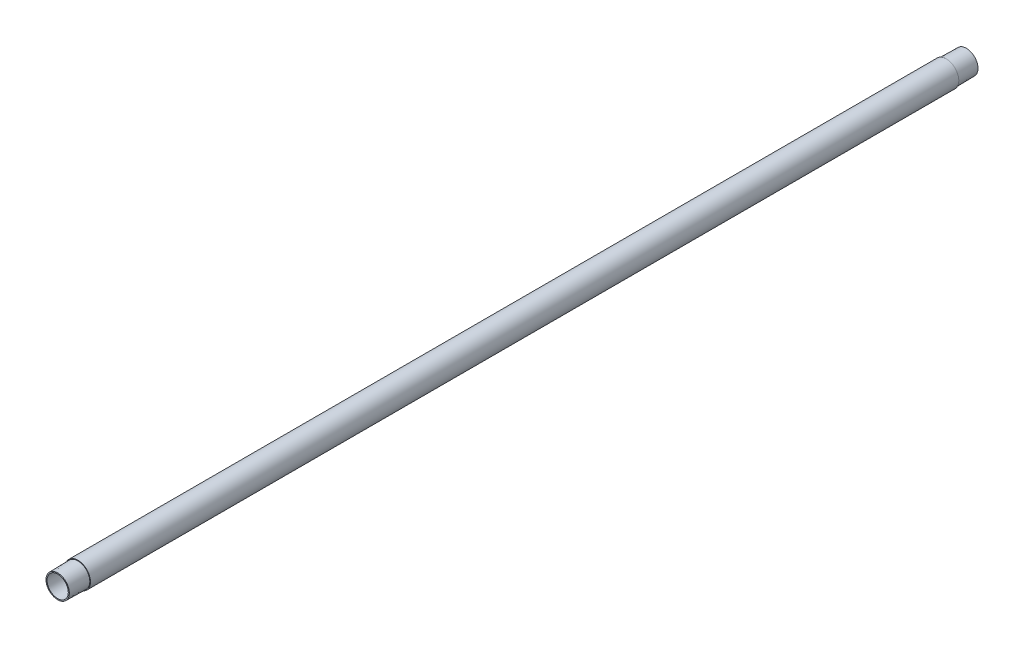
from build123d import *

# Parameters (mm, degrees)
SKETCH2_R           = 6.35
SKETCH2_R_2         = 5.334
BOSS_EXTRUDE1_DEPTH = 457.2


with BuildPart() as part:
    # Sketch2 → Boss-Extrude1 (new body)
    with BuildSketch(Plane.XY):
        Circle(SKETCH2_R)
        Circle(SKETCH2_R_2, mode=Mode.SUBTRACT)
    extrude(amount=BOSS_EXTRUDE1_DEPTH)

    # Sketch3 → Cut-Revolve3 (revolve, cut)
    with BuildSketch(Plane(origin=(0, 0, 0), x_dir=(0, 0, -1), z_dir=(1, 0, 0)), mode=Mode.PRIVATE) as cut_revolve3_sk:
        Polygon((-457.2, 8.954277603), (-457.2, 5.869613211), (-447.050584192, 6.020223087), (-447.050584192, 8.954277603), align=None)
        Polygon((-10.149415808, 8.954277603), (0, 8.954277603), (0, 5.869613211), (-10.149415808, 6.020223087), align=None)
    revolve(cut_revolve3_sk.sketch.rotate(Axis((0, 0, 0), (0, 0, 1)), 90), axis=Axis((0, 0, 0), (0, 0, 1)), mode=Mode.SUBTRACT)


solid = part.part
